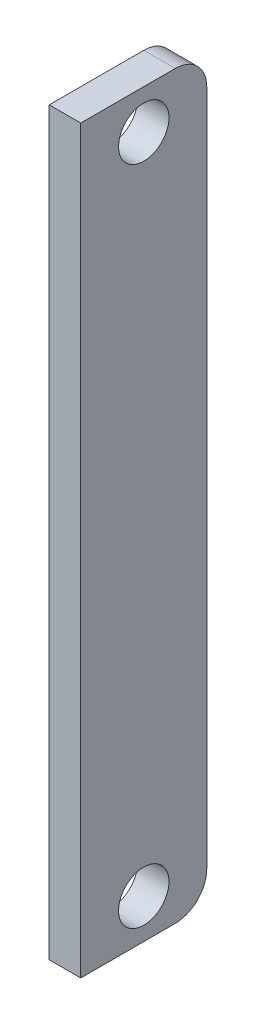
from build123d import *

# Parameters (mm, degrees)
SKIZZE1_W                       = 40
SKIZZE1_H                       = 235
AUFSATZ_LINEAR_AUSTRAGEN1_DEPTH = 10
SKIZZE2_R                       = 8
SCHNITT_LINEAR_AUSTRAGEN1_DEPTH = 120.608737139
VERRUNDUNG1_R                   = 10


with BuildPart() as part:
    # Skizze1 → Aufsatz-Linear austragen1 (new body)
    with BuildSketch(Plane(origin=(0, 0, 0), x_dir=(0, 0, -1), z_dir=(1, 0, 0))):
        Rectangle(SKIZZE1_W, SKIZZE1_H)
    extrude(amount=AUFSATZ_LINEAR_AUSTRAGEN1_DEPTH)

    # Skizze2 → Schnitt-Linear austragen1 (cut, through all)
    with BuildSketch(Plane(origin=(10, 0, 0), x_dir=(0, 0, -1), z_dir=(1, 0, 0))):
        with Locations((0, 105)):
            Circle(SKIZZE2_R)
        with Locations((0, -105)):
            Circle(SKIZZE2_R)
    extrude(amount=-SCHNITT_LINEAR_AUSTRAGEN1_DEPTH, mode=Mode.SUBTRACT)

    # Verrundung1
    verrundung1_edges = [part.edges().sort_by_distance(p)[0] for p in [
        (5, -117.5, -20),
        (5, 117.5, -20),
    ]]
    fillet(verrundung1_edges, radius=VERRUNDUNG1_R)


solid = part.part
